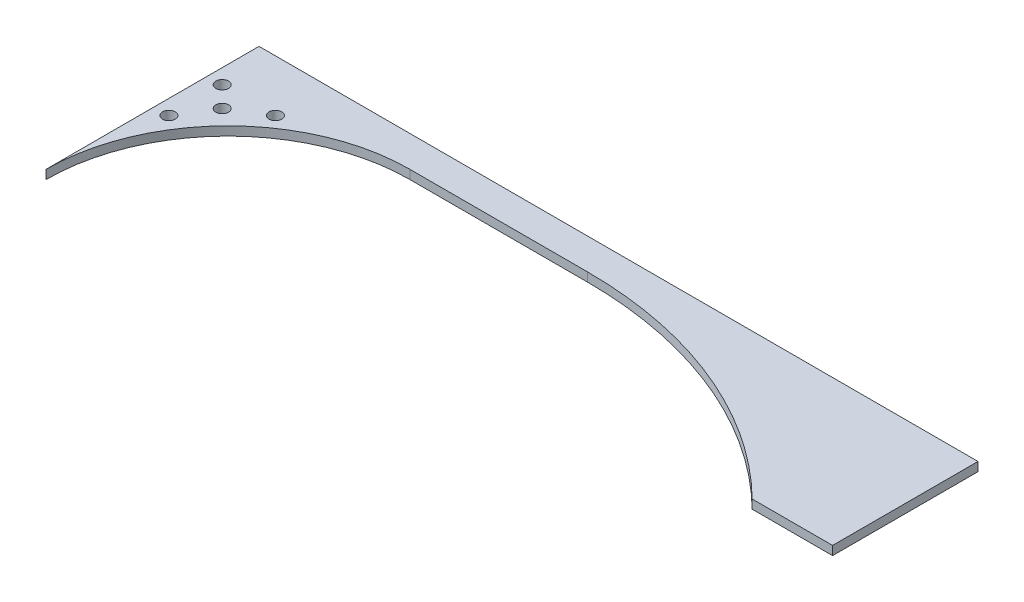
from build123d import *

# Parameters (mm, degrees)
BOSS_EXTRUDE1_DEPTH = 6.35
SKETCH2_W           = 19.05
SKETCH2_H           = 101.6
CUT_EXTRUDE2_DEPTH  = 316.541333465
SKETCH3_R           = 4.572
CUT_EXTRUDE3_DEPTH  = 300.006794446


with BuildPart() as part:
    # Sketch1 → Boss-Extrude1 (new body)
    with BuildSketch(Plane(origin=(0, 0, 0), x_dir=(1, 0, 0), z_dir=(0, 1, 0))):
        with BuildLine():
            Line((-257.175, 0), (257.175, 0))
            Line((257.175, 0), (257.175, -104.032493436))
            Line((257.175, -104.032493436), (199.670208733, -104.032493436))
            ThreePointArc((199.670208733, -104.032493436), (107.889594305, -43.469891278), (0, -22.225))
            Line((0, -22.225), (-127, -22.225))
            ThreePointArc((-127, -22.225), (-219.047625241, -60.352374759), (-257.175, -152.4))
            Line((-257.175, -152.4), (-276.225, -152.4))
            Line((-276.225, -152.4), (-276.225, -50.8))
            Line((-276.225, -50.8), (-257.175, -50.8))
            Line((-257.175, -50.8), (-257.175, 0))
        make_face()
    extrude(amount=BOSS_EXTRUDE1_DEPTH)

    # Sketch2 → Cut-Extrude2 (cut, through all)
    with BuildSketch(Plane(origin=(0, 0, 0), x_dir=(1, 0, 0), z_dir=(0, 1, 0))):
        with Locations((-266.7, -101.6)):
            Rectangle(SKETCH2_W, SKETCH2_H)
    extrude(amount=CUT_EXTRUDE2_DEPTH, mode=Mode.SUBTRACT)

    # Sketch3 → Cut-Extrude3 (cut, through all)
    with BuildSketch(Plane(origin=(0, 6.35, 0), x_dir=(1, 0, 0), z_dir=(0, 1, 0))):
        with Locations(Location((-208.452544448, -36.961239505, 0), (0, 0, 270))):
            Circle(SKETCH3_R)
        with Locations(Location((-246.552544448, -36.961239505, 0), (0, 0, 270))):
            Circle(SKETCH3_R)
        with Locations(Location((-231.855506716, -51.658277238, 0), (0, 0, 270))):
            Circle(SKETCH3_R)
        with Locations(Location((-246.552544448, -75.061239505, 0), (0, 0, 270))):
            Circle(SKETCH3_R)
    extrude(amount=-CUT_EXTRUDE3_DEPTH, mode=Mode.SUBTRACT)


solid = part.part
